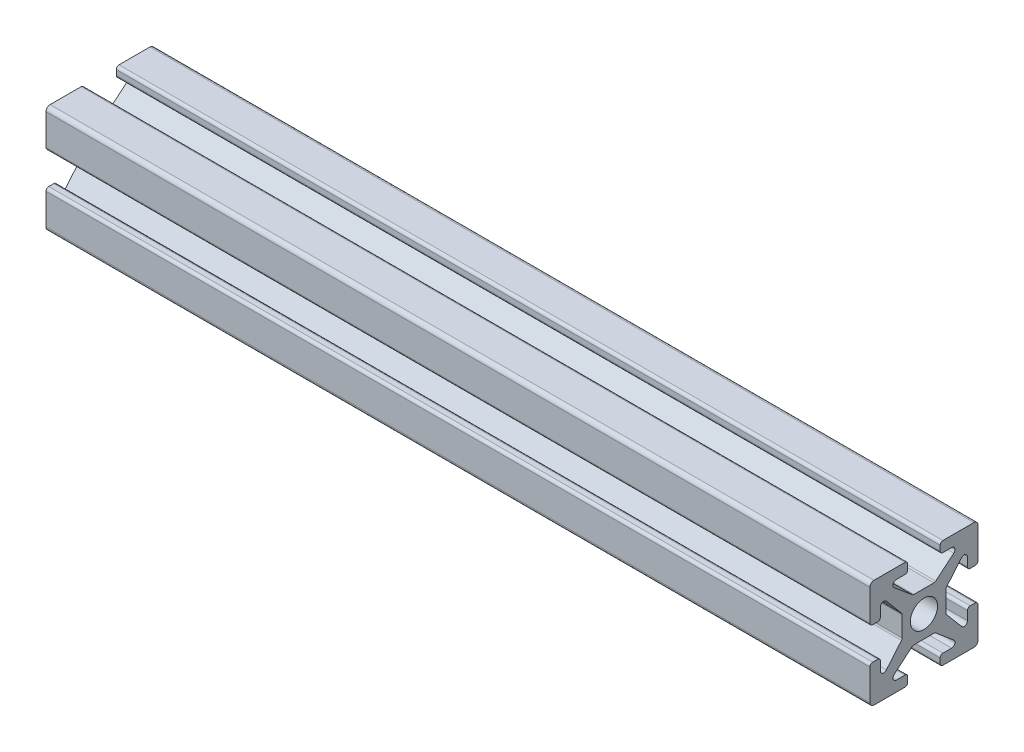
from build123d import *

# Parameters (mm, degrees)
BOSS_EXTRUDE1_START = -38.1
BOSS_EXTRUDE1_DEPTH = 76.2


with BuildPart() as part:
    # Sketch4 → Boss-Extrude1 (new body)
    with BuildSketch(Plane(origin=(0, 0, 0), x_dir=(0, 0, -1), z_dir=(1, 0, 0)).offset(BOSS_EXTRUDE1_START)):
        with BuildLine():
            Line((0, 1.2573), (0, 2.0193))
            Line((0, 2.0193), (0.92659956, 2.0193))
            ThreePointArc((0.92659956, 2.0193), (1.013472677, 2.034618074), (1.089867613, 2.078724711))
            Line((1.089867613, 2.078724711), (2.759770219, 3.479939372))
            ThreePointArc((2.759770219, 3.479939372), (2.851556384, 3.822490003), (2.561056801, 4.0259))
            Line((2.561056801, 4.0259), (1.7526, 4.0259))
            ThreePointArc((1.7526, 4.0259), (1.572994878, 4.100294878), (1.4986, 4.2799))
            Line((1.4986, 4.2799), (1.4986, 4.746))
            ThreePointArc((1.4986, 4.746), (1.572994878, 4.925605122), (1.7526, 5))
            Line((1.7526, 5), (4.619, 5))
            ThreePointArc((4.619, 5), (4.888407684, 4.888407684), (5, 4.619))
            Line((5, 4.619), (5, 1.7526))
            ThreePointArc((5, 1.7526), (4.925605122, 1.572994878), (4.746, 1.4986))
            Line((4.746, 1.4986), (4.2799, 1.4986))
            ThreePointArc((4.2799, 1.4986), (4.100294878, 1.572994878), (4.0259, 1.7526))
            Line((4.0259, 1.7526), (4.0259, 2.561056801))
            ThreePointArc((4.0259, 2.561056801), (3.822490003, 2.851556384), (3.479939372, 2.759770219))
            Line((3.479939372, 2.759770219), (2.078724711, 1.089867613))
            ThreePointArc((2.078724711, 1.089867613), (2.034618074, 1.013472677), (2.0193, 0.92659956))
            Line((2.0193, 0.92659956), (2.0193, 0))
            Line((2.0193, 0), (1.2573, 0))
            ThreePointArc((1.2573, 0), (0.889045356, 0.889045356), (0, 1.2573))
        make_face()
    extrude(amount=BOSS_EXTRUDE1_DEPTH)

    # Mirror1: part across plane


with BuildPart() as part_1:
    add(part.part)
    add(part.part.mirror(Plane.ZX))

    # Mirror2: part across plane


with BuildPart() as part_2:
    add(part_1.part)
    add(part_1.part.mirror(Plane.XY))


solid = part_2.part
